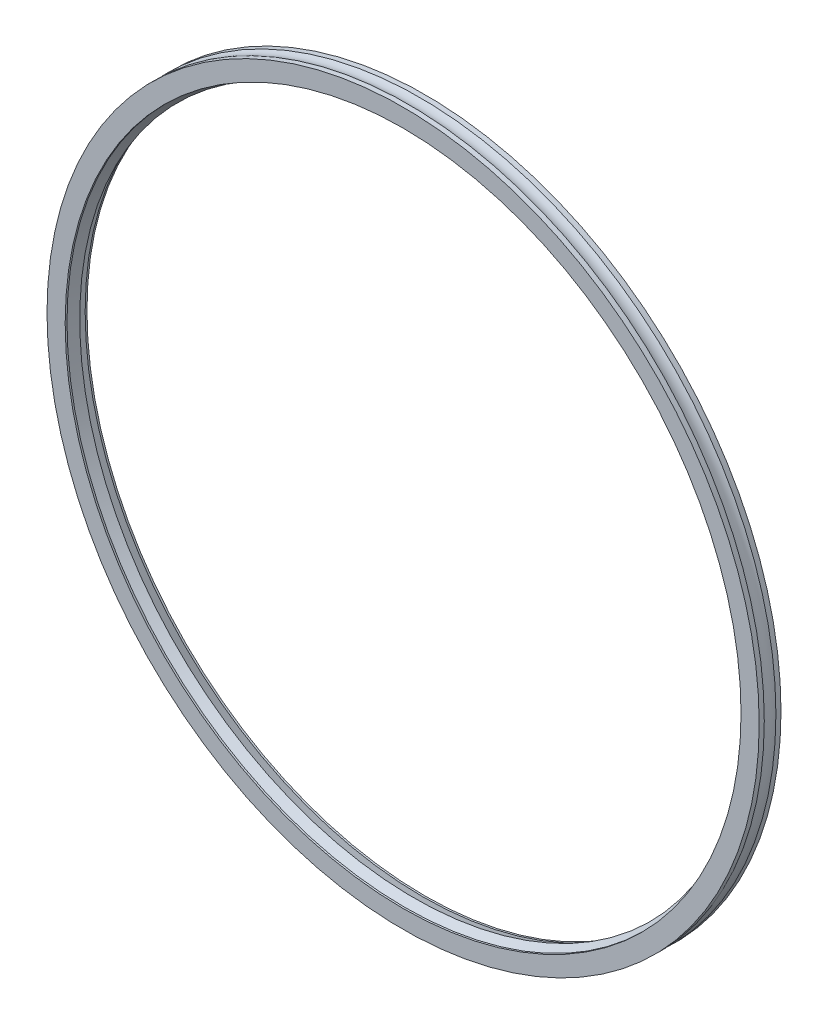
from build123d import *


with BuildPart() as part:
    # Sketch1 → Revolve1 (revolve)
    with BuildSketch(Plane(origin=(0, 0, 0), x_dir=(0, 0, -1), z_dir=(1, 0, 0)), mode=Mode.PRIVATE) as revolve1_sk:
        with BuildLine():
            Line((0.8, 49), (1.5, 49))
            Line((1.5, 49), (1.5, 46.5))
            Line((1.5, 46.5), (1.25, 46.5))
            Line((1.25, 46.5), (0, 46))
            Line((0, 46), (-1.25, 46.5))
            Line((-1.25, 46.5), (-1.5, 46.5))
            Line((-1.5, 46.5), (-1.5, 49))
            Line((-1.5, 49), (-0.8, 49))
            ThreePointArc((-0.8, 49), (0, 48.833030278), (0.8, 49))
        make_face()
    revolve(revolve1_sk.sketch.rotate(Axis((0, 0, 0), (0, 0, -1)), 90), axis=Axis((0, 0, 0), (0, 0, -1)))


solid = part.part
